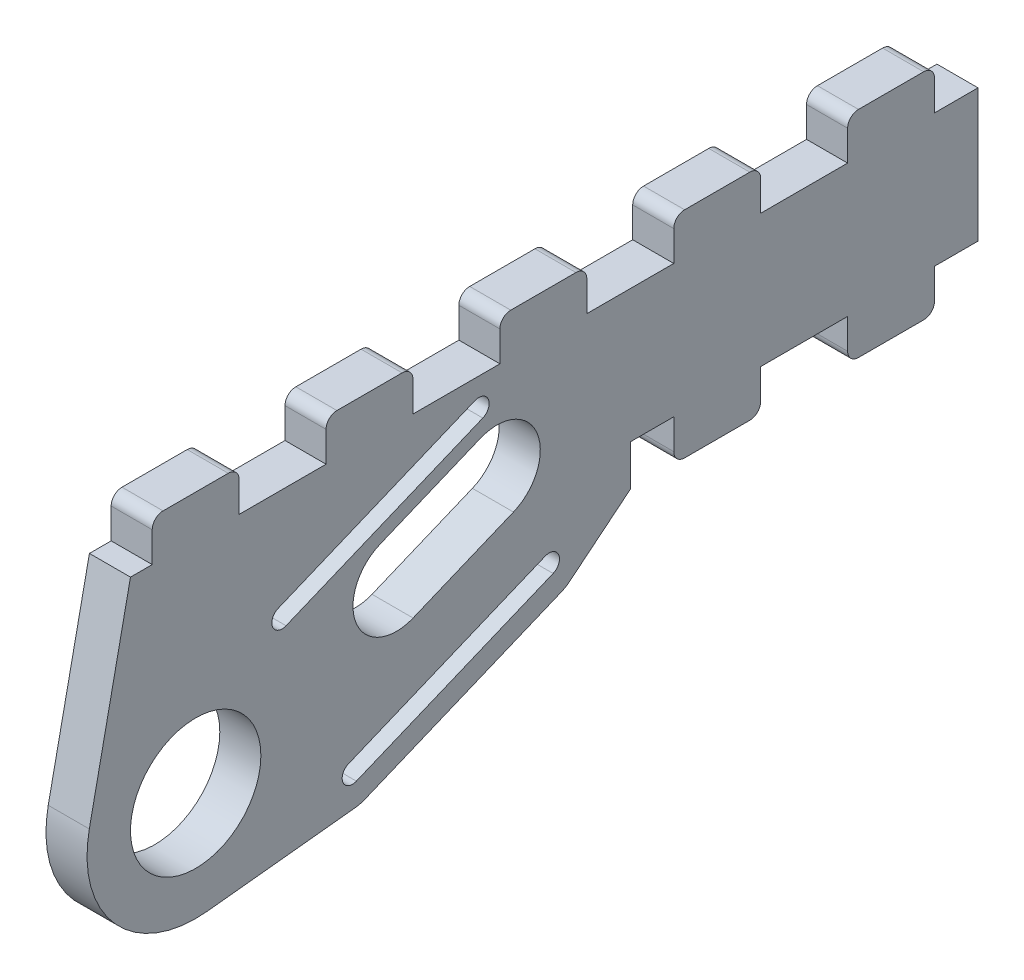
from build123d import *

# Parameters (mm, degrees)
SKETCH1_R              = 9.525
BOSS_EXTRUDE1_DEPTH    = 3
CUT_EXTRUDE1_DEPTH     = 72.404901793
SKETCH4_W              = 50.8
SKETCH4_H              = 19.4
BOSS_EXTRUDE3_DEPTH    = 6
SKETCH3_W              = 6
SKETCH3_H              = 12.7
BOSS_EXTRUDE2_DEPTH    = 6
FILLET1_R              = 1.5875
LPATTERN1_COUNT        = 5
LPATTERN1_PITCH        = 25.4
FILLET1_OF_LPATTERN1_R = 1.5875
SKETCH5_W              = 12.7
SKETCH5_H              = 6
BOSS_EXTRUDE4_DEPTH    = 6
FILLET2_R              = 1.5875
LPATTERN2_COUNT        = 2
LPATTERN2_PITCH        = 25.4
FILLET2_OF_LPATTERN2_R = 1.5875


with BuildPart() as part:
    # Sketch1 → Boss-Extrude1 (new, symmetric)
    with BuildSketch(Plane(origin=(0, 0, 0), x_dir=(0, 0, -1), z_dir=(1, 0, 0))):
        with BuildLine():
            Line((-15.540953853, 3.23950279), (-9.525, 32.1))
            Line((-9.525, 32.1), (63.5, 32.1))
            Line((63.5, 32.1), (63.5, -15.875))
            Line((63.5, -15.875), (0, -15.875))
            ThreePointArc((0, -15.875), (-12.317522717, -10.014702148), (-15.540953853, 3.23950279))
        make_face()
        Circle(SKETCH1_R, mode=Mode.SUBTRACT)
    extrude(amount=BOSS_EXTRUDE1_DEPTH, both=True)

    # Sketch2 → Cut-Extrude1 (cut, through all)
    with BuildSketch(Plane(origin=(3, 0, 0), x_dir=(0, 0, -1), z_dir=(1, 0, 0))):
        with BuildLine():
            Line((1.676231888, -15.786255783), (23.396510982, -13.47993154))
            ThreePointArc((23.396510982, -13.47993154), (24.056064004, -13.361605673), (24.691925535, -13.150202478))
            Line((24.691925535, -13.150202478), (53.43843719, -1.24300748))
            ThreePointArc((53.43843719, -1.24300748), (54.045535898, -0.938110333), (54.602034594, -0.548443406))
            Line((54.602034594, -0.548443406), (63.5, 6.7))
            Line((63.5, 6.7), (63.5, -15.875))
            Line((63.5, -15.875), (0, -15.875))
            ThreePointArc((0, -15.875), (0.839289711, -15.852798421), (1.676231888, -15.786255783))
        make_face()
        with BuildLine():
            Line((26.903135362, 18.016834009), (41.56972294, 24.091933498))
            ThreePointArc((41.56972294, 24.091933498), (49.866397767, 20.655338262), (46.429802531, 12.358663435))
            Line((46.429802531, 12.358663435), (31.763214953, 6.283563946))
            ThreePointArc((31.763214953, 6.283563946), (23.466540126, 9.720159182), (26.903135362, 18.016834009))
        make_face()
        with BuildLine():
            Line((22.328855341, -7.445246365), (51.075366995, 4.461948633))
            ThreePointArc((51.075366995, 4.461948633), (53.035211442, 3.650154483), (52.223417292, 1.690310036))
            Line((52.223417292, 1.690310036), (23.476905638, -10.216884962))
            ThreePointArc((23.476905638, -10.216884962), (21.51706119, -9.405090812), (22.328855341, -7.445246365))
        make_face()
        with BuildLine():
            Line((12.055034553, 17.357951117), (40.801546208, 29.265146115))
            ThreePointArc((40.801546208, 29.265146115), (42.761390655, 28.453351965), (41.949596505, 26.493507518))
            Line((41.949596505, 26.493507518), (13.203084851, 14.58631252))
            ThreePointArc((13.203084851, 14.58631252), (11.243240403, 15.39810667), (12.055034553, 17.357951117))
        make_face()
    extrude(amount=-CUT_EXTRUDE1_DEPTH, mode=Mode.SUBTRACT)

    # Sketch4 → Boss-Extrude3 (add)
    with BuildSketch(Plane(origin=(3, 0, 0), x_dir=(0, 0, -1), z_dir=(1, 0, 0))):
        with Locations((88.9, 22.4)):
            Rectangle(SKETCH4_W, SKETCH4_H)
    extrude(amount=-BOSS_EXTRUDE3_DEPTH)

    # Sketch3 → Boss-Extrude2 (add)
    with BuildSketch(Plane(origin=(0, 32.1, 0), x_dir=(1, 0, 0), z_dir=(0, 1, 0))):
        Rectangle(SKETCH3_W, SKETCH3_H)
    boss_extrude2 = extrude(amount=BOSS_EXTRUDE2_DEPTH)

    # Fillet1
    fillet1_edges = [part.edges().sort_by_distance(p)[0] for p in [
        (0, 38.1, -6.35),
        (0, 38.1, 6.35),
    ]]
    fillet(fillet1_edges, radius=FILLET1_R)

    # LPattern1: Boss-Extrude2 ×5
    with Locations(*[(0, 0, -i * LPATTERN1_PITCH) for i in range(1, LPATTERN1_COUNT)]):
        add(boss_extrude2)

    # Fillet1 of LPattern1
    fillet1_of_lpattern1_edges = [part.edges().sort_by_distance(p)[0] for p in [
        (0, 38.1, -31.75),
        (0, 38.1, -19.05),
        (0, 38.1, -57.15),
        (0, 38.1, -44.45),
        (0, 38.1, -82.55),
        (0, 38.1, -69.85),
        (0, 38.1, -107.95),
        (0, 38.1, -95.25),
    ]]
    fillet(fillet1_of_lpattern1_edges, radius=FILLET1_OF_LPATTERN1_R)

    # Sketch5 → Boss-Extrude4 (add)
    with BuildSketch(Plane.ZY.offset(3)):
        with Locations((-76.2, 9.7)):
            Rectangle(SKETCH5_W, SKETCH5_H)
    boss_extrude4 = extrude(amount=-BOSS_EXTRUDE4_DEPTH)

    # Fillet2
    fillet2_edges = [part.edges().sort_by_distance(p)[0] for p in [
        (0, 6.7, -82.55),
        (0, 6.7, -69.85),
    ]]
    fillet(fillet2_edges, radius=FILLET2_R)

    # LPattern2: Boss-Extrude4 ×2
    with Locations(*[(0, 0, -i * LPATTERN2_PITCH) for i in range(1, LPATTERN2_COUNT)]):
        add(boss_extrude4)

    # Fillet2 of LPattern2
    fillet2_of_lpattern2_edges = [part.edges().sort_by_distance(p)[0] for p in [
        (0, 6.7, -107.95),
        (0, 6.7, -95.25),
    ]]
    fillet(fillet2_of_lpattern2_edges, radius=FILLET2_OF_LPATTERN2_R)


solid = part.part
